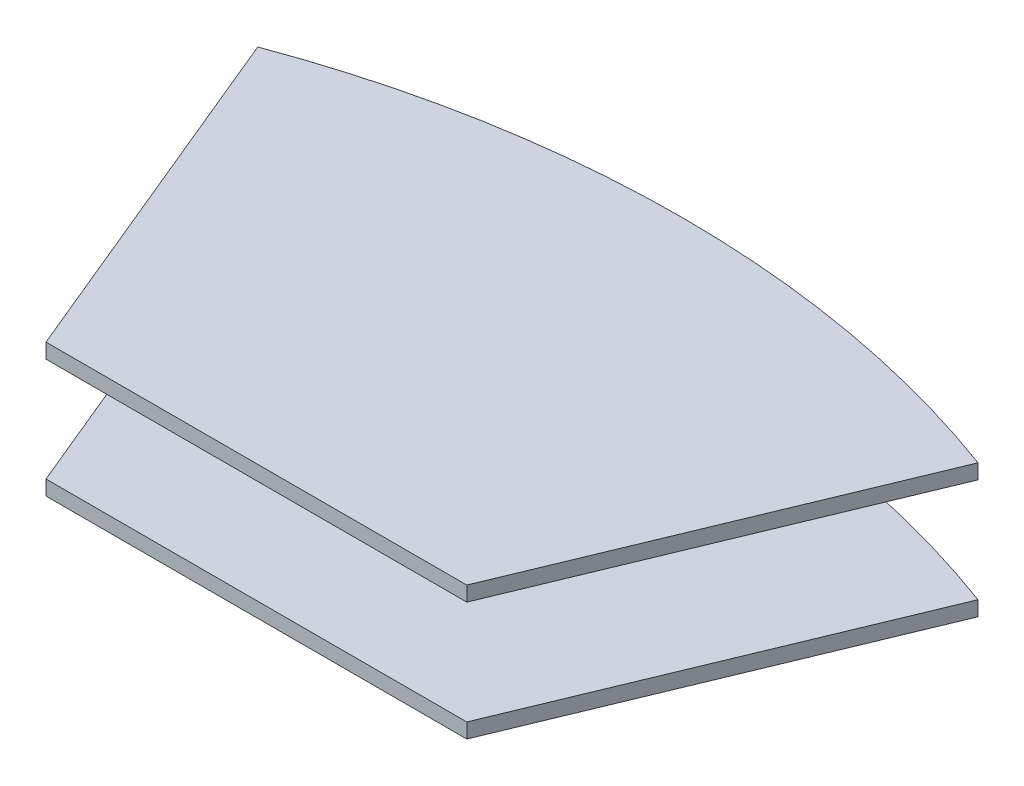
from build123d import *

# Parameters (mm, degrees)
BOSS_EXTRUDE1_DEPTH = 5
BOSS_EXTRUDE2_DEPTH = 35
BOSS_EXTRUDE3_DEPTH = 5


with BuildPart() as part:
    # Sketch1 → Boss-Extrude1 (new body)
    with BuildSketch(Plane(origin=(0, 0, 0), x_dir=(1, 0, 0), z_dir=(0, 1, 0))):
        with BuildLine():
            Line((-121.5, 46.952098291), (-70.985786928, -75))
            Line((-70.985786928, -75), (70.985786928, -75))
            Line((70.985786928, -75), (121.5, 46.952098291))
            ThreePointArc((121.5, 46.952098291), (0, 68.717806969), (-121.5, 46.952098291))
        make_face()
    extrude(amount=BOSS_EXTRUDE1_DEPTH)

    # Sketch2 → Boss-Extrude2 (add)
    with BuildSketch(Plane(origin=(0, 5, 0), x_dir=(1, 0, 0), z_dir=(0, 1, 0))):
        with BuildLine():
            Line((-48.833229971, 2.175293041), (-40.133863978, -18.826834324))
            ThreePointArc((-40.133863978, -18.826834324), (-36.450770983, -23.314696123), (-30.895068653, -25))
            Line((-30.895068653, -25), (30.895068653, -25))
            ThreePointArc((30.895068653, -25), (36.450770983, -23.314696123), (40.133863978, -18.826834324))
            Line((40.133863978, -18.826834324), (48.833229971, 2.175293041))
            ThreePointArc((48.833229971, 2.175293041), (48.269800459, 10.975861174), (40.959759978, 15.90848324))
            ThreePointArc((40.959759978, 15.90848324), (0, 18.717806969), (-40.959759978, 15.90848324))
            ThreePointArc((-40.959759978, 15.90848324), (-48.269800459, 10.975861174), (-48.833229971, 2.175293041))
        make_face()
    extrude(amount=BOSS_EXTRUDE2_DEPTH)

    # Sketch3 → Boss-Extrude3 (add)
    with BuildSketch(Plane(origin=(0, 40, 0), x_dir=(1, 0, 0), z_dir=(0, 1, 0))):
        with BuildLine():
            Line((-121.5, 46.952098291), (-70.985786928, -75))
            Line((-70.985786928, -75), (70.985786928, -75))
            Line((70.985786928, -75), (121.5, 46.952098291))
            ThreePointArc((121.5, 46.952098291), (0, 68.717806969), (-121.5, 46.952098291))
        make_face()
    extrude(amount=BOSS_EXTRUDE3_DEPTH)


solid = part.part
